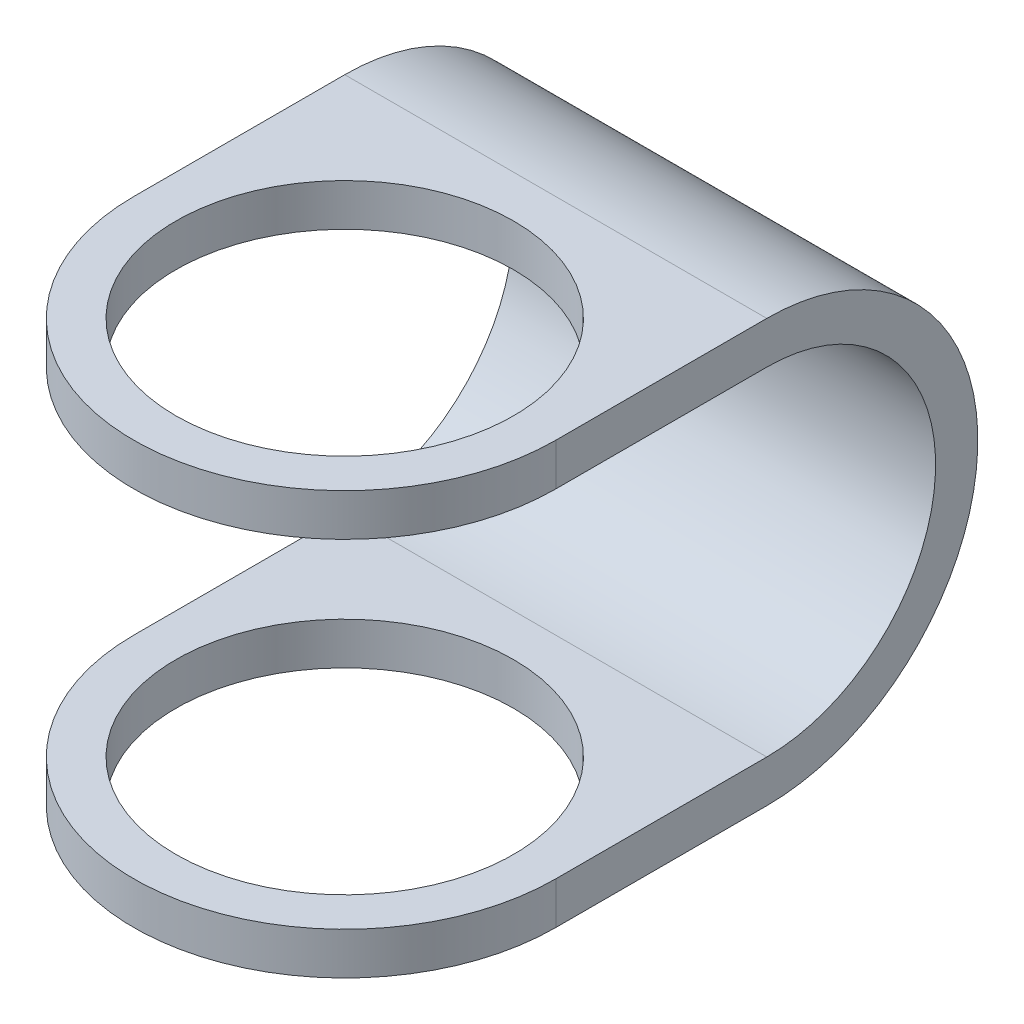
from build123d import *

# Parameters (mm, degrees)
EXTRUDE_1_DEPTH     = 100
CUT_EXTRUDE_1_DEPTH = 207.155281281
FILLET_1_RADIUS     = 50
FILLET_1_LENGTH     = 10
FILLET_2_RADIUS     = 50
FILLET_2_LENGTH     = 10
SKETCH_3_R          = 40
CUT_EXTRUDE_2_DEPTH = 207.155281281


with BuildPart() as part:
    # 草圖1 → 填料-伸長1 (new body)
    with BuildSketch(Plane(origin=(0, 0, 0), x_dir=(0, 0, -1), z_dir=(1, 0, 0))):
        with BuildLine():
            Line((0, 0), (100, 0))
            ThreePointArc((100, 0), (150, 50), (100, 100))
            Line((100, 100), (0, 100))
            Line((0, 100), (0, 0))
        make_face()
    extrude(amount=EXTRUDE_1_DEPTH)

    # 草圖2 → 除料-伸長1 (cut, through all)
    with BuildSketch(Plane(origin=(100, 0, 0), x_dir=(0, 0, -1), z_dir=(1, 0, 0))):
        with BuildLine():
            Line((-26.438322174, 10), (-26.438322174, 90))
            Line((-26.438322174, 90), (100, 90))
            ThreePointArc((100, 90), (140, 50), (100, 10))
            Line((100, 10), (-26.438322174, 10))
        make_face()
    extrude(amount=-CUT_EXTRUDE_1_DEPTH, mode=Mode.SUBTRACT)

    # 圓角1: full round fillet: the end face becomes a half cylinder, R = half its width
    fillet_1_face = Plane((50, 95, 0), x_dir=(0, 1, 0), z_dir=(0, 0, 1))  # on the end face: x along it, z out of the body
    fillet_1_slab = fillet_1_face.offset(-FILLET_1_RADIUS / 2) * Box(FILLET_1_LENGTH, 2 * FILLET_1_RADIUS, FILLET_1_RADIUS, mode=Mode.PRIVATE)  # the body's end, R deep
    fillet_1_round = Plane((50, 95, -50), x_dir=(0, 0, 1), z_dir=(0, 1, 0)) * Cylinder(FILLET_1_RADIUS, FILLET_1_LENGTH, mode=Mode.PRIVATE)  # its axis R under the face
    add(fillet_1_slab - fillet_1_round, mode=Mode.SUBTRACT)

    # 圓角2: full round fillet: the end face becomes a half cylinder, R = half its width
    fillet_2_face = Plane((50, 5, 0), x_dir=(0, -1, 0), z_dir=(0, 0, 1))  # on the end face: x along it, z out of the body
    fillet_2_slab = fillet_2_face.offset(-FILLET_2_RADIUS / 2) * Box(FILLET_2_LENGTH, 2 * FILLET_2_RADIUS, FILLET_2_RADIUS, mode=Mode.PRIVATE)  # the body's end, R deep
    fillet_2_round = Plane((50, 5, -50), x_dir=(0, 0, 1), z_dir=(0, -1, 0)) * Cylinder(FILLET_2_RADIUS, FILLET_2_LENGTH, mode=Mode.PRIVATE)  # its axis R under the face
    add(fillet_2_slab - fillet_2_round, mode=Mode.SUBTRACT)

    # 草圖3 → 除料-伸長2 (cut, through all)
    with BuildSketch(Plane(origin=(0, 100, 0), x_dir=(1, 0, 0), z_dir=(0, 1, 0))):
        with Locations(Location((50, 50, 0), (0, 0, 270))):
            Circle(SKETCH_3_R)
    extrude(amount=-CUT_EXTRUDE_2_DEPTH, mode=Mode.SUBTRACT)


solid = part.part
